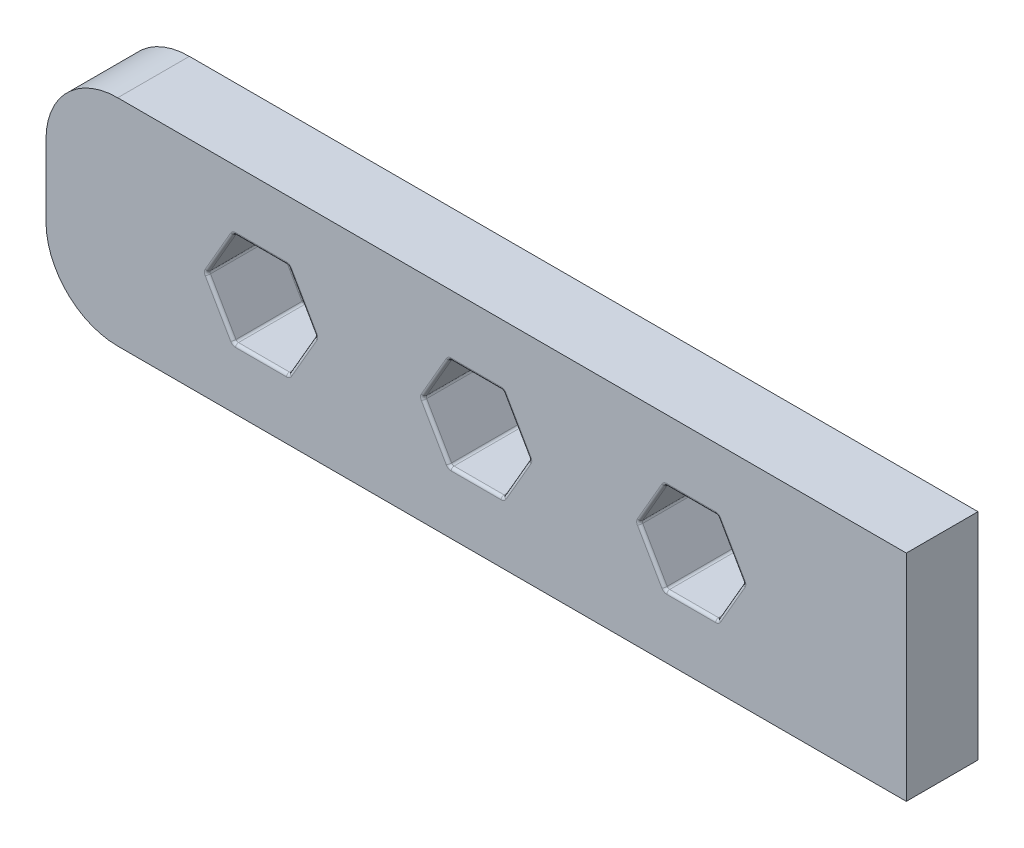
from build123d import *

# Parameters (mm, degrees)
BOSS_EXTRUDE1_DEPTH = 5
CUT_EXTRUDE3_DEPTH  = 5
FILLET1_R           = 0.2


with BuildPart() as part:
    # Sketch1 → Boss-Extrude1 (new body)
    with BuildSketch(Plane.XY):
        with BuildLine():
            Line((-25, -7.5), (30, -7.5))
            Line((30, -7.5), (30, 7.5))
            Line((30, 7.5), (-25, 7.5))
            ThreePointArc((-25, 7.5), (-28.535533906, 6.035533906), (-30, 2.5))
            Line((-30, 2.5), (-30, -2.5))
            ThreePointArc((-30, -2.5), (-28.535533906, -6.035533906), (-25, -7.5))
        make_face()
    extrude(amount=BOSS_EXTRUDE1_DEPTH)

    # Sketch2 → Cut-Extrude3 (cut)
    with BuildSketch(Plane.XY):
        Polygon((-11.218355737, 0), (-13.109177868, 3.275), (-16.890822132, 3.275), (-18.781644263, 0), (-16.890822132, -3.275), (-13.109177868, -3.275), align=None)
        Polygon((3.70947548, 0), (1.85473774, 3.2125), (-1.85473774, 3.2125), (-3.70947548, 0), (-1.85473774, -3.2125), (1.85473774, -3.2125), align=None)
        Polygon((18.637306696, 0), (16.818653348, 3.15), (13.181346652, 3.15), (11.362693304, 0), (13.181346652, -3.15), (16.818653348, -3.15), align=None)
    extrude(amount=CUT_EXTRUDE3_DEPTH, mode=Mode.SUBTRACT)

    # Fillet1
    fillet1_edges = [part.edges().sort_by_distance(p)[0] for p in [
        (-12.163766803, -1.6375, 0),
        (-13.109177868, -3.275, 2.5),
        (-12.163766803, 1.6375, 0),
        (-11.218355737, 0, 2.5),
        (-15, 3.275, 0),
        (-13.109177868, 3.275, 2.5),
        (-17.836233197, 1.6375, 0),
        (-16.890822132, 3.275, 2.5),
        (-17.836233197, -1.6375, 0),
        (-18.781644263, 0, 2.5),
        (-15, -3.275, 0),
        (-16.890822132, -3.275, 2.5),
        (-12.163766803, -1.6375, 5),
        (-12.163766803, 1.6375, 5),
        (-15, 3.275, 5),
        (-17.836233197, 1.6375, 5),
        (-17.836233197, -1.6375, 5),
        (-15, -3.275, 5),
        (2.78210661, -1.60625, 0),
        (1.85473774, -3.2125, 2.5),
        (2.78210661, 1.60625, 0),
        (3.70947548, 0, 2.5),
        (0, 3.2125, 0),
        (1.85473774, 3.2125, 2.5),
        (-2.78210661, 1.60625, 0),
        (-1.85473774, 3.2125, 2.5),
        (-2.78210661, -1.60625, 0),
        (-3.70947548, 0, 2.5),
        (0, -3.2125, 0),
        (-1.85473774, -3.2125, 2.5),
        (2.78210661, -1.60625, 5),
        (2.78210661, 1.60625, 5),
        (0, 3.2125, 5),
        (-2.78210661, 1.60625, 5),
        (-2.78210661, -1.60625, 5),
        (0, -3.2125, 5),
        (17.727980022, -1.575, 0),
        (16.818653348, -3.15, 2.5),
        (17.727980022, 1.575, 0),
        (18.637306696, 0, 2.5),
        (15, 3.15, 0),
        (16.818653348, 3.15, 2.5),
        (12.272019978, 1.575, 0),
        (13.181346652, 3.15, 2.5),
        (12.272019978, -1.575, 0),
        (11.362693304, 0, 2.5),
        (15, -3.15, 0),
        (13.181346652, -3.15, 2.5),
        (17.727980022, -1.575, 5),
        (17.727980022, 1.575, 5),
        (15, 3.15, 5),
        (12.272019978, 1.575, 5),
        (12.272019978, -1.575, 5),
        (15, -3.15, 5),
    ]]
    fillet(fillet1_edges, radius=FILLET1_R)


solid = part.part
